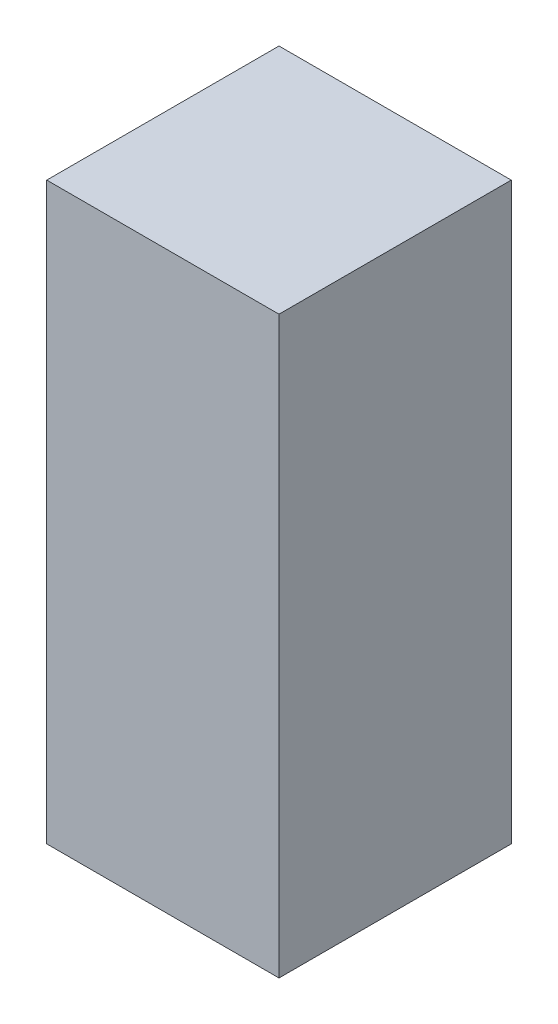
from build123d import *

# Parameters (mm, degrees)
SKETCH2_W           = 5.1308
SKETCH2_H           = 12.7
BOSS_EXTRUDE1_DEPTH = 5.1308


with BuildPart() as part:
    # Sketch2 → Boss-Extrude1 (new body)
    with BuildSketch(Plane(origin=(0, 0, 0), x_dir=(0, 0, -1), z_dir=(1, 0, 0))):
        Rectangle(SKETCH2_W, SKETCH2_H)
    extrude(amount=BOSS_EXTRUDE1_DEPTH)


solid = part.part
